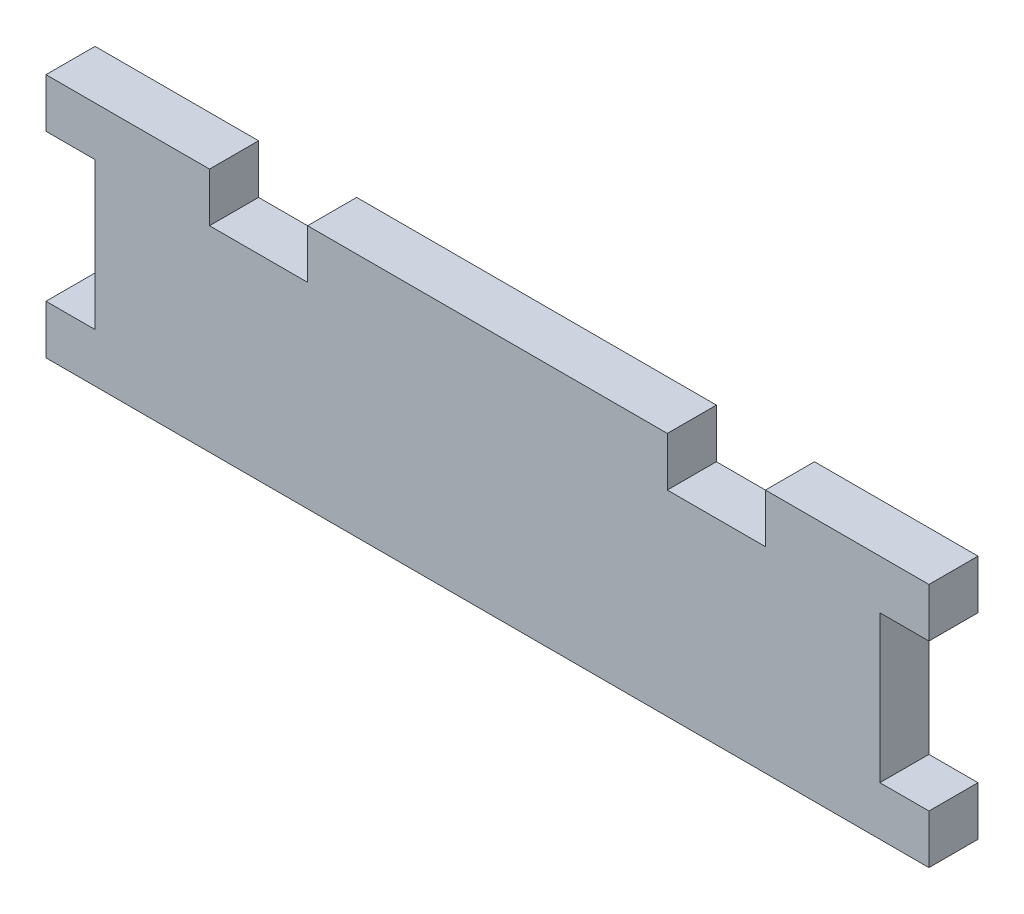
from build123d import *

# Parameters (mm, degrees)
BOSS_EXTRUDE1_DEPTH = 3


with BuildPart() as part:
    # Sketch1 → Boss-Extrude1 (new body)
    with BuildSketch(Plane.XY):
        Polygon((0, 3), (0, 0), (54, 0), (54, 3), (51, 3), (51, 12), (54, 12), (54, 15), (44, 15), (44, 12), (38, 12), (38, 15), (16, 15), (16, 12), (10, 12), (10, 15), (0, 15), (0, 12), (3, 12), (3, 3), align=None)
    extrude(amount=BOSS_EXTRUDE1_DEPTH)


solid = part.part
